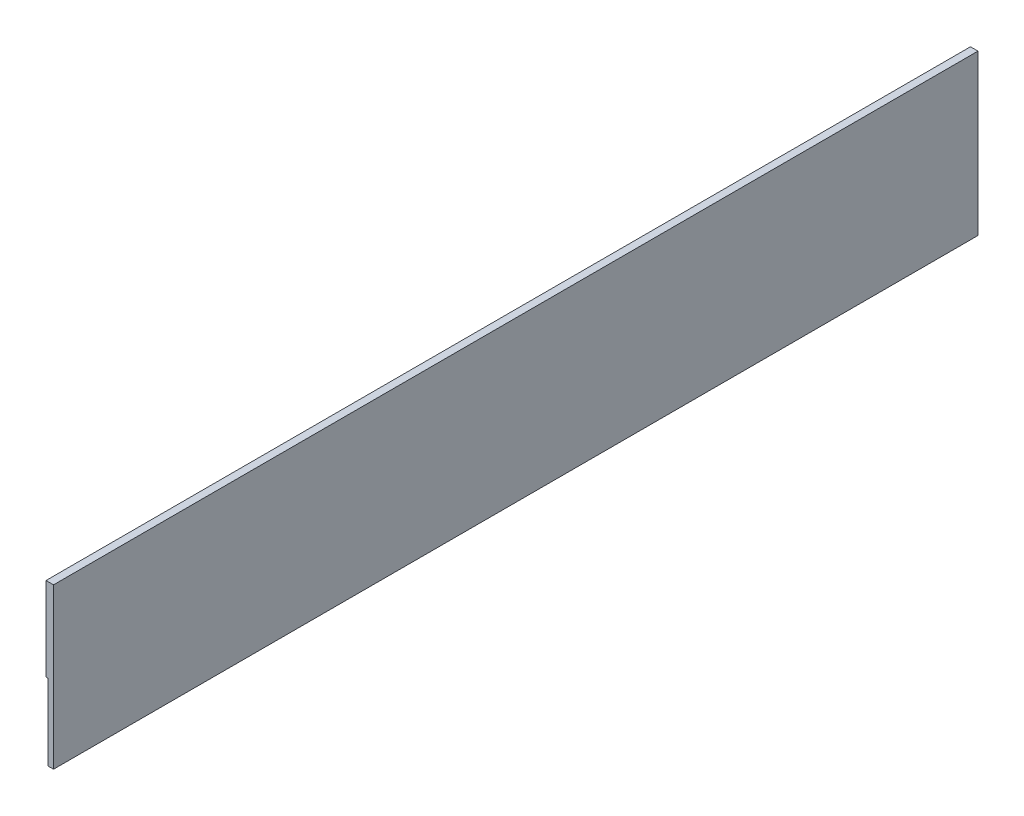
from build123d import *

# Parameters (mm, degrees)
SKETCH1_W           = 12496.8
SKETCH1_H           = 2159
BOSS_EXTRUDE1_DEPTH = 76.2
SKETCH2_W           = 12496.8
SKETCH2_H           = 1130.3
BOSS_EXTRUDE2_DEPTH = 25.4


with BuildPart() as part:
    # Sketch1 → Boss-Extrude1 (new body)
    with BuildSketch(Plane(origin=(0, 0, 0), x_dir=(0, 0, -1), z_dir=(1, 0, 0))):
        with Locations((6248.4, 1079.5)):
            Rectangle(SKETCH1_W, SKETCH1_H)
    extrude(amount=BOSS_EXTRUDE1_DEPTH)

    # Sketch2 → Boss-Extrude2 (add)
    with BuildSketch(Plane.ZY):
        with Locations((-6248.4, 1593.85)):
            Rectangle(SKETCH2_W, SKETCH2_H)
    extrude(amount=BOSS_EXTRUDE2_DEPTH)


solid = part.part
